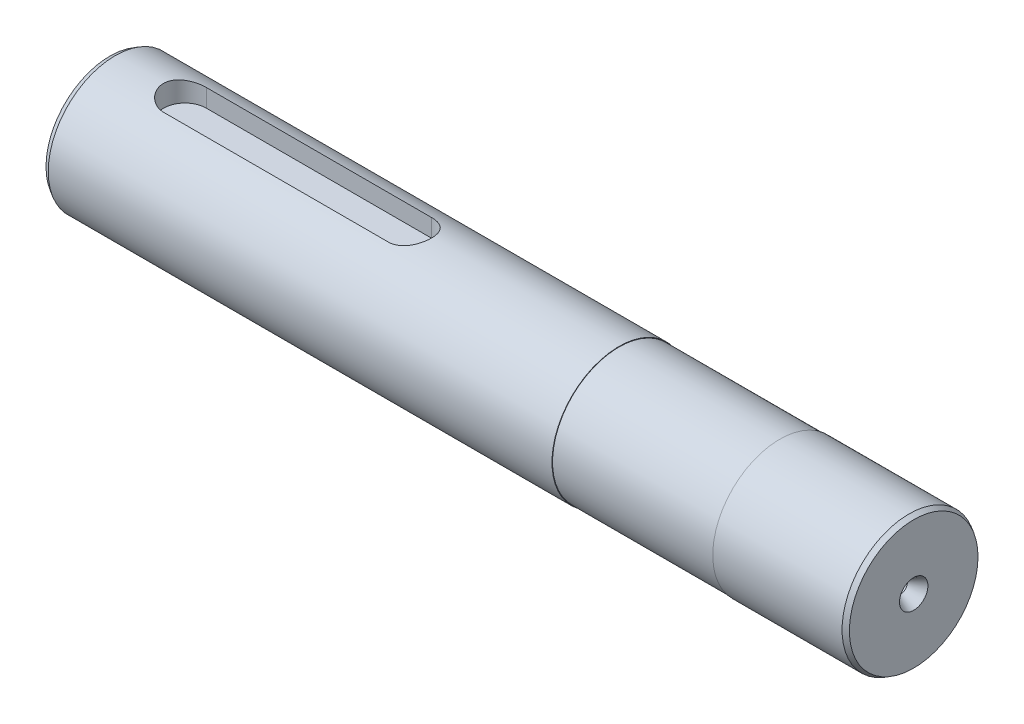
from build123d import *

# Parameters (mm, degrees)
M8_GEWINDEBOHRUNG1_D            = 6.8
M8_GEWINDEBOHRUNG1_DEPTH        = 22.25
M8_GEWINDEBOHRUNG1_CSINK_D      = 9
M8_GEWINDEBOHRUNG1_CSINK_ANGLE  = 60
M8_GEWINDEBOHRUNG1_TIP          = 2.042926105
FASE1_SIZE                      = 1
FASE1_SIZE2                     = 0.577350269
SCHNITT_LINEAR_AUSTRAGEN1_DEPTH = 4


with BuildPart() as part:
    # Skizze1 → Rotation1 (revolve)
    with BuildSketch(Plane(origin=(0, 0, 0), x_dir=(1, 0, 0), z_dir=(0, 1, 0))):
        Polygon((0, 0), (0, 12.5), (95, 12.5), (95, 12.4), (125, 12.4), (125, 12.5), (149.133974596, 12.5), (150, 12), (150, 0), align=None)
    revolve(axis=Axis((0, 0, 0), (-1, 0, 0)))

    # Skizze3 → Schnitt-Rotation1 (revolve, cut)
    with BuildSketch(Plane(origin=(150, 0, 0), x_dir=(0, 0, -1), z_dir=(0, -1, 0)), mode=Mode.PRIVATE) as schnitt_rotation1_sk:
        Polygon((0, -5.351075774), (1.25, -4.6), (1.25, -2.424871131), (2.65, 0), (0, 0), align=None)
    revolve(schnitt_rotation1_sk.sketch.rotate(Axis((150, 0, 0), (-1, 0, 0)), 270), axis=Axis((150, 0, 0), (-1, 0, 0)), mode=Mode.SUBTRACT)

    # M8 Gewindebohrung1
    with Locations(Plane.ZY):
        with Locations((0, 0)):
            CounterSinkHole(M8_GEWINDEBOHRUNG1_D / 2, M8_GEWINDEBOHRUNG1_CSINK_D / 2, depth=M8_GEWINDEBOHRUNG1_DEPTH, counter_sink_angle=M8_GEWINDEBOHRUNG1_CSINK_ANGLE)
            with Locations((0, 0, -(M8_GEWINDEBOHRUNG1_DEPTH + M8_GEWINDEBOHRUNG1_TIP / 2))):  # 118° drill point
                Cone(0, M8_GEWINDEBOHRUNG1_D / 2, M8_GEWINDEBOHRUNG1_TIP, mode=Mode.SUBTRACT)

    # Fase1
    fase1_edges = [part.edges().sort_by_distance(p)[0] for p in [
        (0, 0, 12.5),
    ]]
    fase1_side = [part.faces().sort_by_distance(p)[0] for p in [
        (47.5, 0, 12.5),
    ]]
    chamfer(fase1_edges, length=FASE1_SIZE, length2=FASE1_SIZE2, reference=fase1_side[0])

    # Skizze2 → Schnitt-Linear austragen1 (cut)
    with BuildSketch(Plane(origin=(0, 12.5, 4.921019115), x_dir=(1, 0, 0), z_dir=(0, 1, 0))):
        with BuildLine():
            Line((14, 8.921019115), (56, 8.921019115))
            ThreePointArc((56, 8.921019115), (60, 4.921019115), (56, 0.921019115))
            Line((56, 0.921019115), (14, 0.921019115))
            ThreePointArc((14, 0.921019115), (10, 4.921019115), (14, 8.921019115))
        make_face()
    extrude(amount=-SCHNITT_LINEAR_AUSTRAGEN1_DEPTH, mode=Mode.SUBTRACT)


solid = part.part
